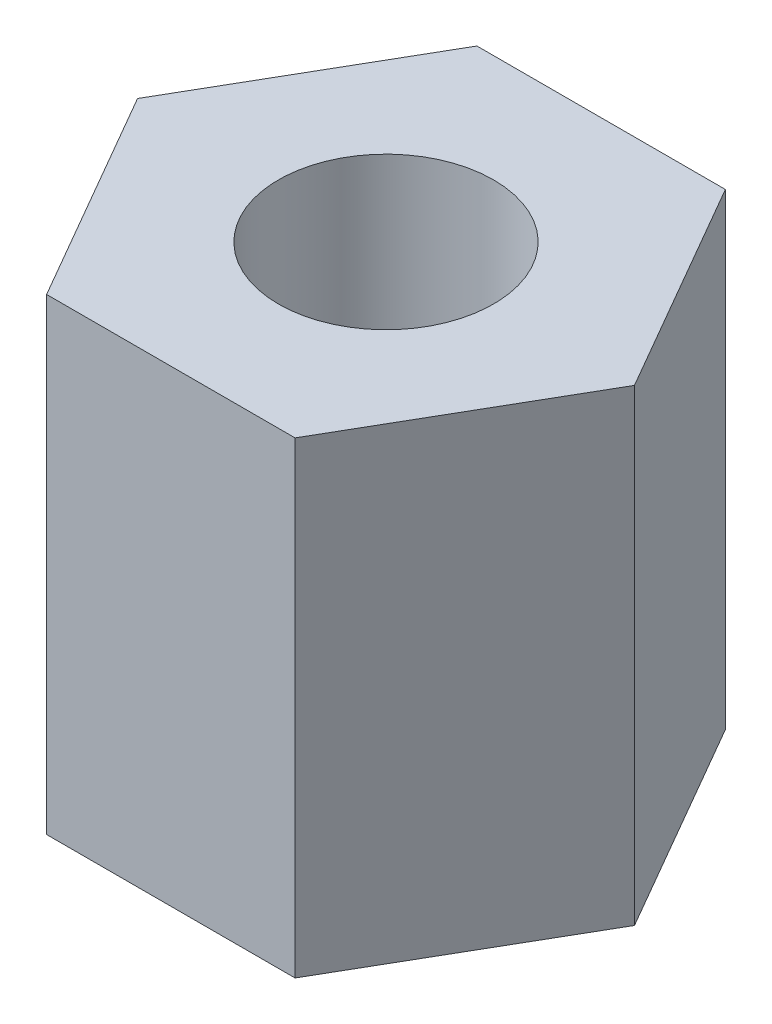
from build123d import *

# Parameters (mm, degrees)
SKETCH1_R           = 2.3
BOSS_EXTRUDE1_DEPTH = 5


with BuildPart() as part:
    # Sketch1 → Boss-Extrude1 (new, symmetric)
    with BuildSketch(Plane(origin=(0, 0, 0), x_dir=(1, 0, 0), z_dir=(0, 1, 0))):
        Polygon((5.311622477, 0), (2.655811238, 4.6), (-2.655811238, 4.6), (-5.311622477, 0), (-2.655811238, -4.6), (2.655811238, -4.6), align=None)
        with Locations(Location((0, 0, 0), (0, 0, 270))):
            Circle(SKETCH1_R, mode=Mode.SUBTRACT)
    extrude(amount=BOSS_EXTRUDE1_DEPTH, both=True)


solid = part.part
